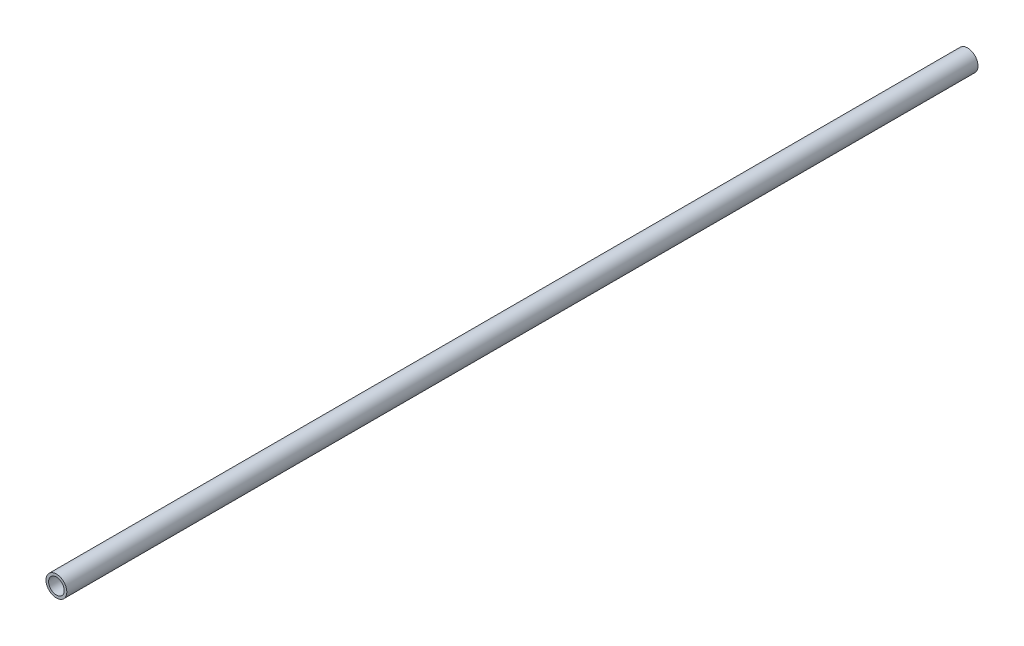
from build123d import *

# Parameters (mm, degrees)
SKETCH_1_R      = 4
SKETCH_1_R_2    = 3
EXTRUDE_1_DEPTH = 350


with BuildPart() as part:
    # 草图1 → 凸台-拉伸1 (new body)
    with BuildSketch(Plane.XY):
        Circle(SKETCH_1_R)
        Circle(SKETCH_1_R_2, mode=Mode.SUBTRACT)
    extrude(amount=EXTRUDE_1_DEPTH)


solid = part.part
